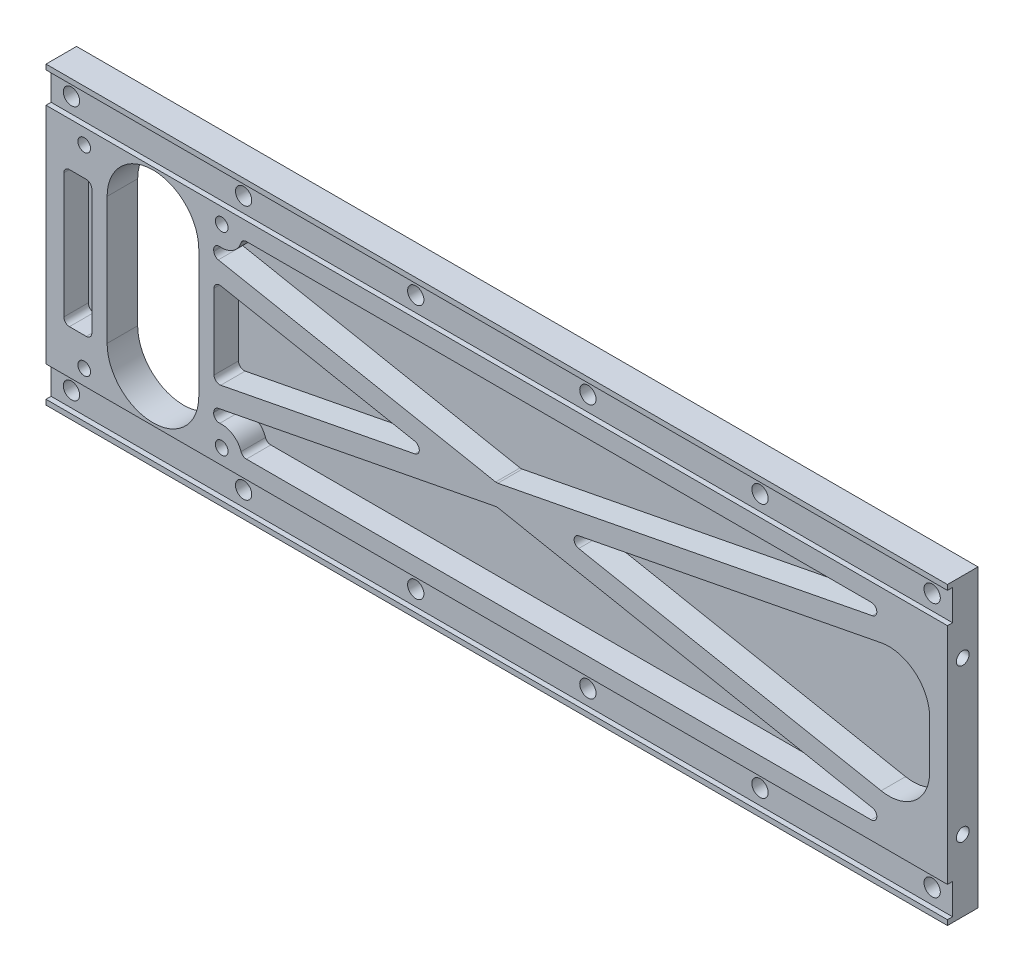
from build123d import *

# Parameters (mm, degrees)
SKETCH_1_W               = 177
SKETCH_1_H               = 58
EXTRUDE_1_DEPTH          = 3
CUT_EXTRUDE_START        = 3
SKETCH_1_3_W             = 177
SKETCH_1_3_H             = 6
CUT_EXTRUDE_1_DEPTH      = 1
CUT_EXTRUDE_2_DEPTH      = 94.178591962
CUT_EXTRUDE_2_DEPTH_BACK = 94.178591962
HOLE_WIZARD_M3_1_D       = 3.2
M3X0_5_2_D               = 2.5
M3X0_5_2_ON_FACE_2_D     = 2.5
CUT_EXTRUDE_5_DEPTH      = 4.8
FILLET_4_R               = 8
FILLET_5_R               = 1.1
M3X0_5_1_D               = 2.5
M3X0_5_1_DEPTH           = 8.5
M3X0_5_1_TIP             = 0.751075774
M3X0_5_1_ON_FACE_2_D     = 2.5
M3X0_5_1_ON_FACE_2_DEPTH = 8.5
M3X0_5_1_ON_FACE_2_TIP   = 0.751075774


with BuildPart() as part:
    # ｽｹｯﾁ1 → ﾎﾞｽ - 押し出し1 (new, symmetric)
    with BuildSketch(Plane.XY):
        Rectangle(SKETCH_1_W, SKETCH_1_H)
    extrude(amount=EXTRUDE_1_DEPTH, both=True)

    # ｽｹｯﾁ1<3> → ｶｯﾄ - 押し出し1 (cut)
    with BuildSketch(Plane.XY.offset(CUT_EXTRUDE_START)):
        with Locations((0, -25)):
            Rectangle(SKETCH_1_3_W, SKETCH_1_3_H)
        with Locations((0, 25)):
            Rectangle(SKETCH_1_3_W, SKETCH_1_3_H)
    extrude(amount=-CUT_EXTRUDE_1_DEPTH, mode=Mode.SUBTRACT)

    # ｽｹｯﾁ1<4> → ｶｯﾄ - 押し出し2 (cut, two sides: drawn at the far end of the back side and taken through both)
    with BuildSketch(Plane.XY.offset(-CUT_EXTRUDE_2_DEPTH_BACK)):
        with BuildLine():
            Line((-58.5, 12.5), (-58.5, -12.5))
            ThreePointArc((-58.5, -12.5), (-67.5, -21.5), (-76.5, -12.5))
            Line((-76.5, -12.5), (-76.5, 12.5))
            ThreePointArc((-76.5, 12.5), (-67.5, 21.5), (-58.5, 12.5))
        make_face()
    extrude(amount=CUT_EXTRUDE_2_DEPTH + CUT_EXTRUDE_2_DEPTH_BACK, mode=Mode.SUBTRACT)

    # M3 すきま穴1 (through all)
    with Locations(Plane(origin=(-84.5, -25, -3), x_dir=(-1, 0, 0), z_dir=(0, 0, -1))):
        with Locations((0, 0), (-33.8, 0), (-67.6, 0), (-101.4, 0), (-135.2, 0), (-169, 0), (-169, 50), (-135.2, 50), (-101.4, 50), (-67.6, 50), (-33.8, 50), (0, 50)):
            Hole(HOLE_WIZARD_M3_1_D / 2)

    # M3x0.5 ねじ穴2 (through all)
    with Locations(Plane(origin=(-81, 19, 3), x_dir=(1, 0, 0), z_dir=(0, 0, 1))):
        with Locations((0, 0), (0, -38), (27, -38)):
            Hole(M3X0_5_2_D / 2)

    # M3x0.5 ねじ穴2 on face 2 (through all)
    with Locations(Plane(origin=(-54, 19, -3), x_dir=(-1, 0, 0), z_dir=(0, 0, -1))):
        with Locations((0, 0)):
            Hole(M3X0_5_2_ON_FACE_2_D / 2)

    # ｽｹｯﾁ12 → ｶｯﾄ - 押し出し5 (cut)
    with BuildSketch(Plane.XY.offset(3)):
        with BuildLine():
            Line((-85, 13.354524038), (-85, -13.354524038))
            Line((-85, -13.354524038), (-79.469535859, -13.354524038))
            ThreePointArc((-79.469535859, -13.354524038), (-79.492381546, -12.927533448), (-79.5, -12.5))
            Line((-79.5, -12.5), (-79.5, 12.5))
            ThreePointArc((-79.5, 12.5), (-79.492381546, 12.927533448), (-79.469535859, 13.354524038))
            Line((-79.469535859, 13.354524038), (-85, 13.354524038))
        make_face()
        with BuildLine():
            Line((-50.031373033, -18.5), (85, -18.5))
            Line((85, -18.5), (0, -2.037166752))
            Line((0, -2.037166752), (-55.503434775, -12.78709371))
            ThreePointArc((-55.503434775, -12.78709371), (-55.612117039, -14.136532524), (-55.872105383, -15.46514195))
            ThreePointArc((-55.872105383, -15.46514195), (-52.155700259, -15.450555189), (-50.031373033, -18.5))
        make_face()
        Polygon((85, -14.425666496), (85, 14.425666496), (10.518187928, 0), align=None)
        with BuildLine():
            Line((85, 18.5), (-50.031373033, 18.5))
            ThreePointArc((-50.031373033, 18.5), (-52.155700259, 15.450555189), (-55.872105383, 15.46514195))
            ThreePointArc((-55.872105383, 15.46514195), (-55.612117039, 14.136532524), (-55.503434775, 12.78709371))
            Line((-55.503434775, 12.78709371), (0, 2.037166752))
            Line((0, 2.037166752), (85, 18.5))
        make_face()
        Polygon((-55.5, -8.712094957), (-55.5, 8.712094957), (-10.518187928, 0), align=None)
    extrude(amount=-CUT_EXTRUDE_5_DEPTH, mode=Mode.SUBTRACT)

    # ﾌｨﾚｯﾄ4
    fillet_4_edges = [part.edges().sort_by_distance(p)[0] for p in [
        (85, -14.425666496, 0.6),
        (85, 14.425666496, 0.6),
    ]]
    fillet(fillet_4_edges, radius=FILLET_4_R)

    # ﾌｨﾚｯﾄ5
    fillet_5_edges = [part.edges().sort_by_distance(p)[0] for p in [
        (85, -18.5, 0.6),
        (0, -2.037166752, 0.6),
        (-55.503434775, -12.78709371, 0.6),
        (-55.872105383, -15.46514195, 0.6),
        (-50.031373033, -18.5, 0.6),
        (-50.031373033, 18.5, 0.6),
        (-55.872105383, 15.46514195, 0.6),
        (-55.503434775, 12.78709371, 0.6),
        (0, 2.037166752, 0.6),
        (85, 18.5, 0.6),
        (10.518187928, 0, 0.6),
        (-55.5, -8.712094957, 0.6),
        (-10.518187928, 0, 0.6),
        (-55.5, 8.712094957, 0.6),
        (-85, -13.354524038, 0.6),
        (-79.469535859, -13.354524038, 0.6),
        (-85, 13.354524038, 0.6),
        (-79.469535859, 13.354524038, 0.6),
    ]]
    fillet(fillet_5_edges, radius=FILLET_5_R)

    # M3x0.5 ねじ穴1
    with Locations(Plane(origin=(-88.5, 15, 0), x_dir=(0, 0, -1), z_dir=(-1, 0, 0))):
        with Locations((0, 0), (0, 30)):
            Hole(M3X0_5_1_D / 2, depth=M3X0_5_1_DEPTH)
            with Locations((0, 0, -(M3X0_5_1_DEPTH + M3X0_5_1_TIP / 2))):  # 118° drill point
                Cone(0, M3X0_5_1_D / 2, M3X0_5_1_TIP, mode=Mode.SUBTRACT)

    # M3x0.5 ねじ穴1 on face 2
    with Locations(Plane(origin=(88.5, 15, 0), x_dir=(0, 0, 1), z_dir=(1, 0, 0))):
        with Locations((0, 0), (0, 30)):
            Hole(M3X0_5_1_ON_FACE_2_D / 2, depth=M3X0_5_1_ON_FACE_2_DEPTH)
            with Locations((0, 0, -(M3X0_5_1_ON_FACE_2_DEPTH + M3X0_5_1_ON_FACE_2_TIP / 2))):  # 118° drill point
                Cone(0, M3X0_5_1_ON_FACE_2_D / 2, M3X0_5_1_ON_FACE_2_TIP, mode=Mode.SUBTRACT)


solid = part.part
